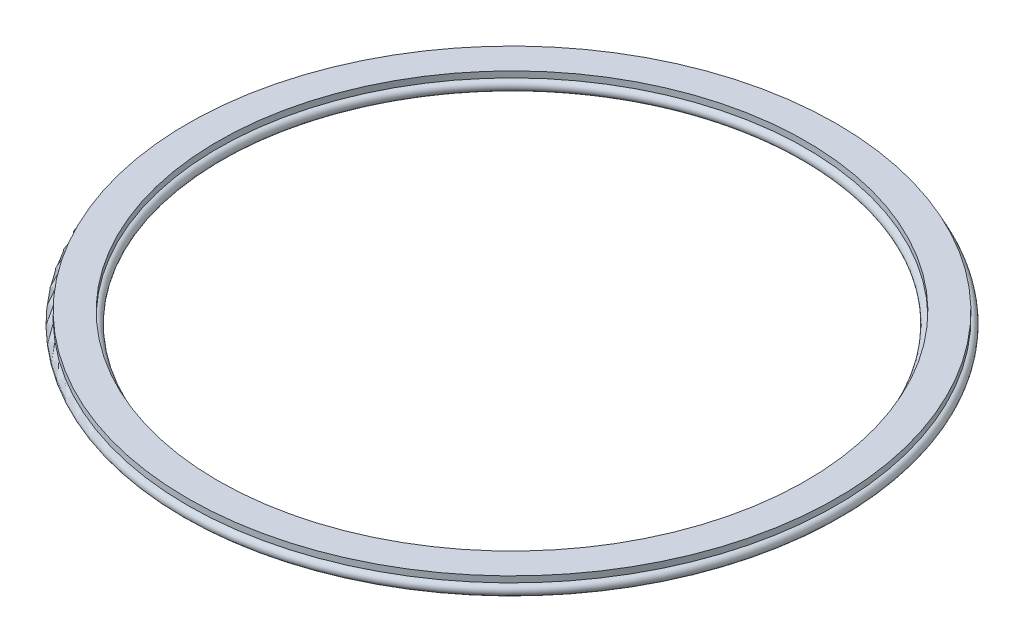
from build123d import *


with BuildPart() as part:
    # Sketch1 → Revolve1 (revolve)
    with BuildSketch(Plane.XY, mode=Mode.PRIVATE) as revolve1_sk:
        with BuildLine():
            Line((295, -11), (295, -6))
            Line((295, -6), (315, -6))
            Line((315, -6), (315, -11))
            ThreePointArc((315, -11), (323.535533906, -14.535533906), (320, -6))
            Line((320, -6), (320, 0))
            Line((320, 0), (290, 0))
            Line((290, 0), (290, -6))
            ThreePointArc((290, -6), (286.464466094, -14.535533906), (295, -11))
        make_face()
    revolve(revolve1_sk.sketch.rotate(Axis((0, 0, 0), (0, -1, 0)), 90), axis=Axis((0, 0, 0), (0, -1, 0)))


solid = part.part
